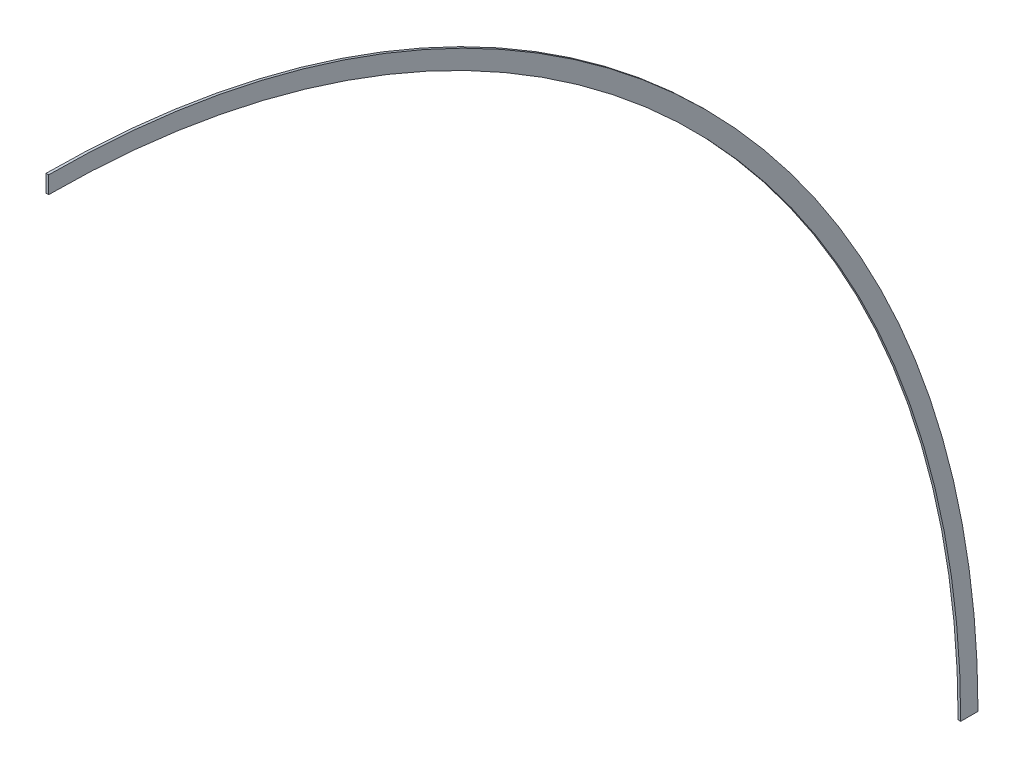
from build123d import *

# Parameters (mm, degrees)
BOSS_EXTRUDE1_DEPTH = 3


with BuildPart() as part:
    # Sketch1 → Boss-Extrude1 (new body)
    with BuildSketch(Plane(origin=(0, 0, 0), x_dir=(0, 0, -1), z_dir=(1, 0, 0))):
        with BuildLine():
            Line((0, 1057), (0, 1077))
            ThreePointArc((0, 1077), (761.554003338, 761.554003338), (1077, 0))
            Line((1077, 0), (1057, 0))
            ThreePointArc((1057, 0), (747.411867714, 747.411867714), (0, 1057))
        make_face()
    extrude(amount=BOSS_EXTRUDE1_DEPTH)


solid = part.part
